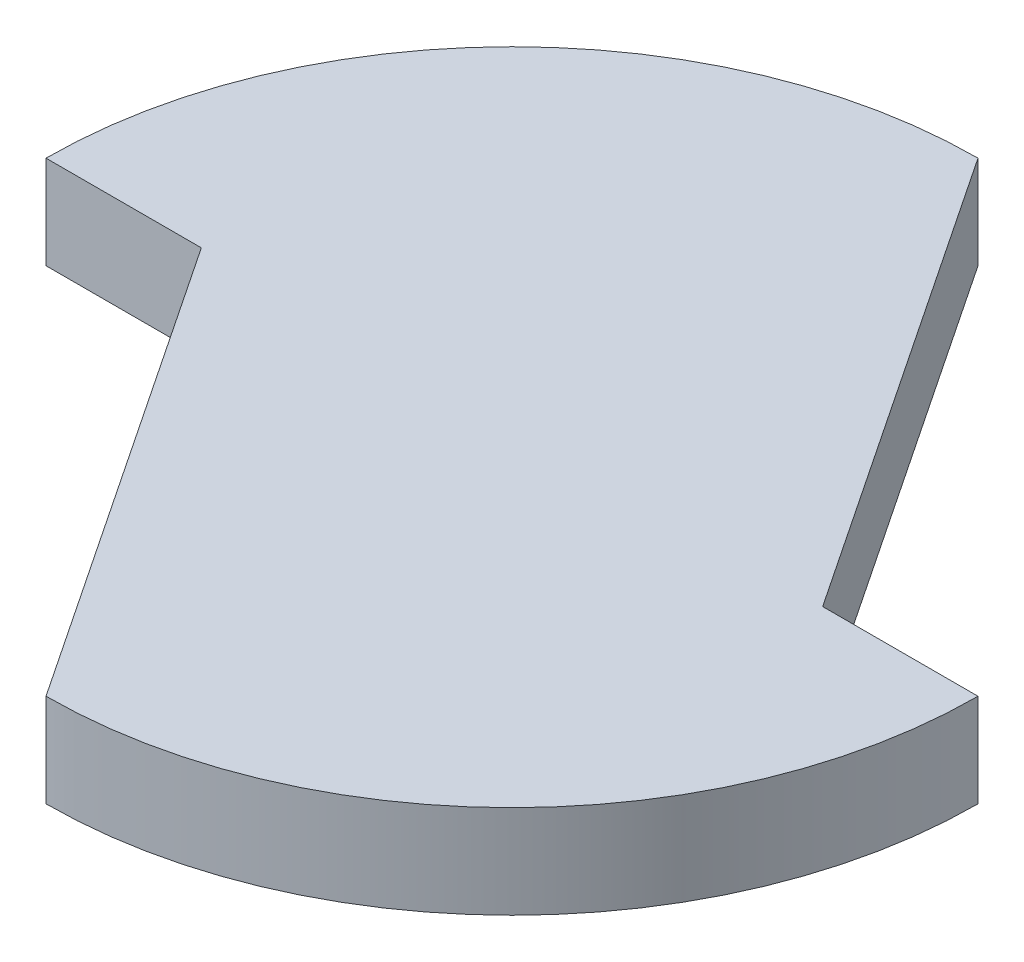
from build123d import *

# Parameters (mm, degrees)
SKETCH1_R           = 15
BOSS_EXTRUDE1_DEPTH = 3
CUT_EXTRUDE2_START  = -8
CUT_EXTRUDE2_DEPTH  = 8


with BuildPart() as part:
    # Sketch1 → Boss-Extrude1 (new body)
    with BuildSketch(Plane(origin=(0, 0, 0), x_dir=(1, 0, 0), z_dir=(0, 1, 0))):
        with Locations(Location((0, 0, 0), (0, 0, 270))):
            Circle(SKETCH1_R)
    extrude(amount=BOSS_EXTRUDE1_DEPTH)

    # Sketch3 → Cut-Extrude2 (cut)
    with BuildSketch(Plane(origin=(0, 3, 0), x_dir=(1, 0, 0), z_dir=(0, 1, 0)).offset(CUT_EXTRUDE2_START)):
        with BuildLine():
            Line((0, -15), (-10, 0))
            Line((-10, 0), (-15, 0))
            ThreePointArc((-15, 0), (-10.606601718, -10.606601718), (0, -15))
        make_face()
        with BuildLine():
            Line((0, 15), (10, 0))
            Line((10, 0), (15, 0))
            ThreePointArc((15, 0), (10.606601718, 10.606601718), (0, 15))
        make_face()
    extrude(amount=CUT_EXTRUDE2_DEPTH, mode=Mode.SUBTRACT)


solid = part.part
